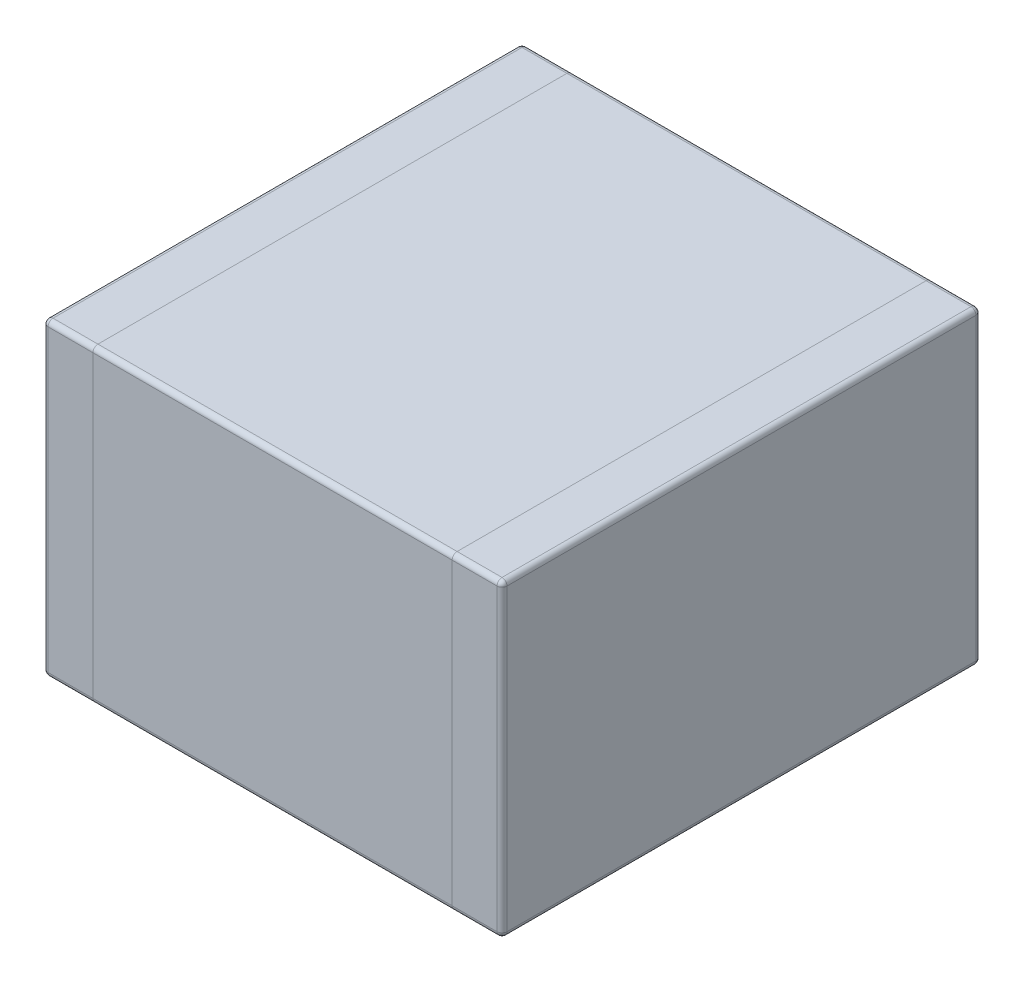
from build123d import *

# Parameters (mm, degrees)
SKETCH1_W      = 4.6
SKETCH1_H      = 4.8
EXTRUDE1_DEPTH = 3.1
FILLET1_R      = 0.05


with BuildPart() as part:
    # Sketch1 → Extrude1 (new body)
    with BuildSketch(Plane(origin=(0, 0, 0), x_dir=(1, 0, 0), z_dir=(0, 1, 0))):
        Rectangle(SKETCH1_W, SKETCH1_H)
    extrude(amount=EXTRUDE1_DEPTH)

    # Fillet1
    fillet1_edges = [part.edges().sort_by_distance(p)[0] for p in [
        (-2.3, 3.1, 0),
        (0, 3.1, 2.4),
        (2.3, 3.1, 0),
        (0, 0, 2.4),
        (-2.3, 0, 0),
        (0, 0, -2.4),
        (2.3, 0, 0),
        (0, 3.1, -2.4),
        (2.3, 1.55, 2.4),
        (-2.3, 1.55, 2.4),
        (-2.3, 1.55, -2.4),
        (2.3, 1.55, -2.4),
    ]]
    fillet(fillet1_edges, radius=FILLET1_R)


solid = part.part
